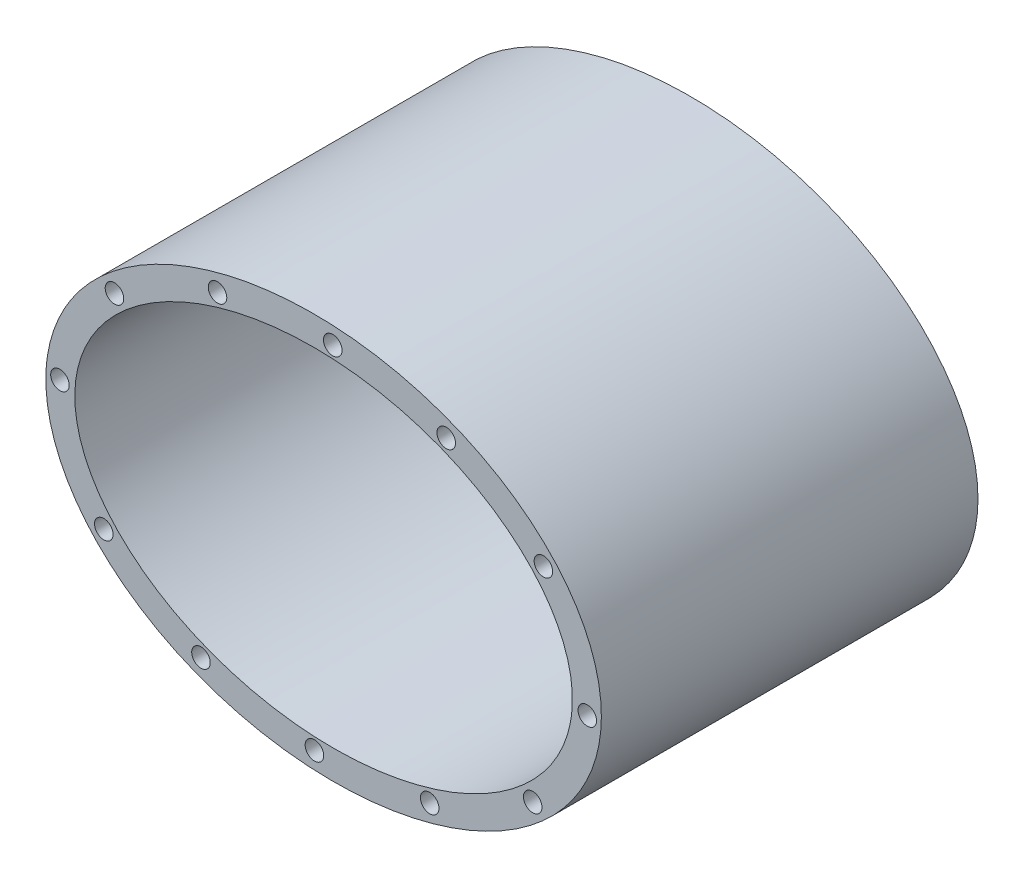
from build123d import *

# Parameters (mm, degrees)
SKETCH4_RX          = 30.459679461
SKETCH4_RY          = 21.634037943
BOSS_EXTRUDE3_DEPTH = 20.6375
SHELL2_T            = -3.175
SKETCH5_R           = 1.016
CUT_EXTRUDE1_DEPTH  = 56.67269803


with BuildPart() as part:
    # Sketch4 → Boss-Extrude3 (new, symmetric)
    with BuildSketch(Plane.XY):
        with Locations(Location((0, 0), (0, 0, 177.081565279))):
            Ellipse(SKETCH4_RX, SKETCH4_RY)
    extrude(amount=BOSS_EXTRUDE3_DEPTH, both=True)

    # Shell2
    shell2_openings = [part.faces().sort_by_distance(p)[0] for p in [
        (0, 0, 20.6375),
    ]]
    offset(amount=SHELL2_T, openings=shell2_openings, kind=Kind.INTERSECTION)

    # Sketch5 → Cut-Extrude1 (cut, through all)
    with BuildSketch(Plane.XY.offset(20.6375)):
        with Locations((-28.895588611, 1.473108439)):
            Circle(SKETCH5_R)
        with Locations((1.00596942, 19.732477078)):
            Circle(SKETCH5_R)
        with Locations((28.895588611, -1.473108439)):
            Circle(SKETCH5_R)
        with Locations((-1.00596942, -19.732477078)):
            Circle(SKETCH5_R)
        with Locations((-11.625914311, 18.418889086)):
            Circle(SKETCH5_R)
        with Locations((-22.917092915, 12.677910499)):
            Circle(SKETCH5_R)
        with Locations((13.43877555, 17.141081368)):
            Circle(SKETCH5_R)
        with Locations((24.087577456, 10.28159397)):
            Circle(SKETCH5_R)
        with Locations((22.917092915, -12.677910499)):
            Circle(SKETCH5_R)
        with Locations((11.625914311, -18.418889086)):
            Circle(SKETCH5_R)
        with Locations((-24.087577456, -10.28159397)):
            Circle(SKETCH5_R)
        with Locations((-13.43877555, -17.141081368)):
            Circle(SKETCH5_R)
    extrude(amount=-CUT_EXTRUDE1_DEPTH, mode=Mode.SUBTRACT)


solid = part.part
